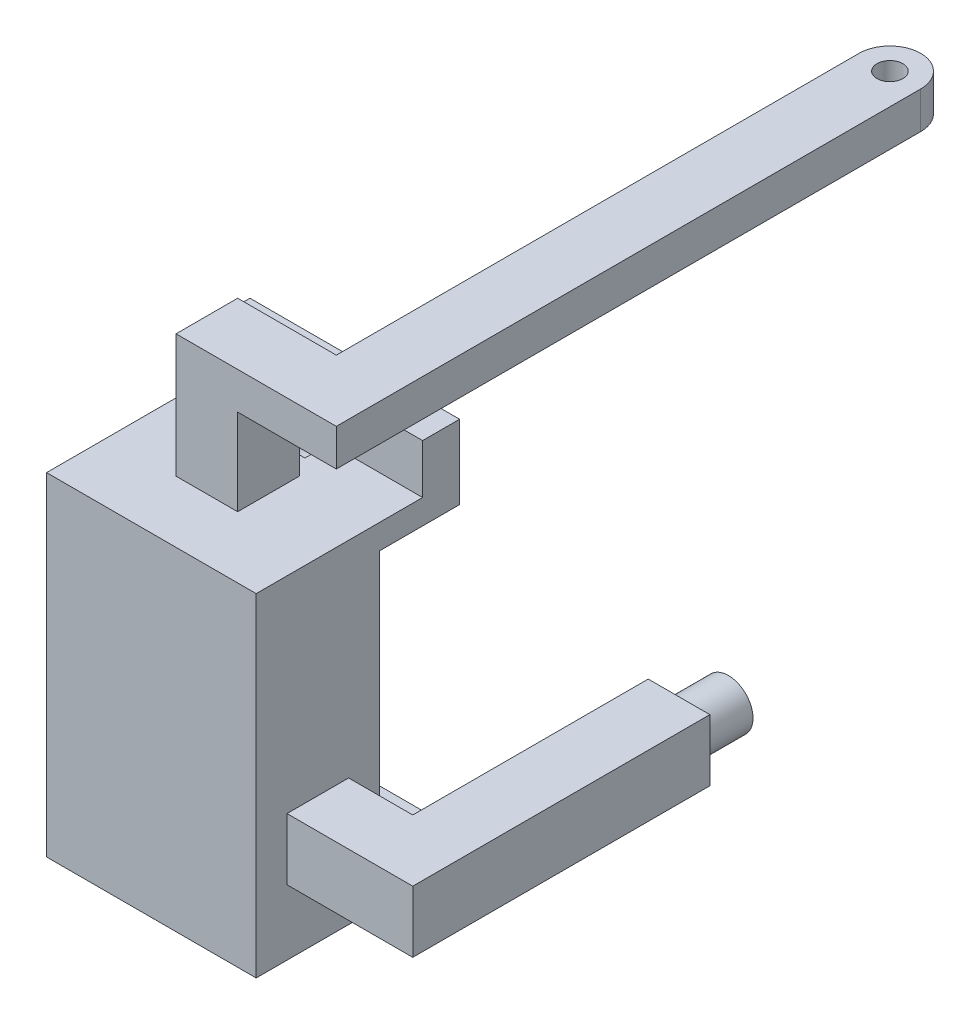
from build123d import *

# Parameters (mm, degrees)
SKETCH1_W            = 4.8
SKETCH1_H            = 4.8
BOSS_EXTRUDE1_DEPTH  = 1
SKETCH2_W            = 5.2
SKETCH2_H            = 5.2
BOSS_EXTRUDE2_DEPTH  = 50
SKETCH3_W            = 17
SKETCH3_H            = 27
BOSS_EXTRUDE3_DEPTH  = 10
SKETCH4_W            = 13
SKETCH4_H            = 23
CUT_EXTRUDE1_DEPTH   = 8.5
SKETCH5_W            = 11
SKETCH5_H            = 4.5
CUT_EXTRUDE2_DEPTH   = 4
SKETCH13_W           = 17
SKETCH13_H           = 27
CUT_EXTRUDE3_DEPTH   = 55.521738784
SKETCH14_W           = 17
SKETCH14_H           = 2
BOSS_EXTRUDE5_DEPTH  = 6.5
SKETCH15_W           = 17
SKETCH15_H           = 3
BOSS_EXTRUDE6_DEPTH  = 4
SKETCH16_R           = 0.95
CUT_EXTRUDE4_DEPTH   = 5
SKETCH17_W           = 5
SKETCH17_H           = 5
BOSS_EXTRUDE7_DEPTH  = 10.2
SKETCH18_W           = 5
SKETCH18_H           = 5
BOSS_EXTRUDE8_DEPTH  = 23.1
SKETCH19_W           = 5
SKETCH19_H           = 5
SKETCH19_R           = 2
CUT_EXTRUDE5_DEPTH   = 4
SKETCH20_R           = 0.5
CUT_EXTRUDE6_DEPTH   = 4
SKETCH21_W           = 5
SKETCH21_H           = 5
BOSS_EXTRUDE9_DEPTH  = 10
SKETCH22_W           = 5
SKETCH22_H           = 3
BOSS_EXTRUDE10_DEPTH = 42.402
SKETCH23_R           = 2.5
BOSS_EXTRUDE11_DEPTH = 3
SKETCH24_R           = 1.05
CUT_EXTRUDE7_DEPTH   = 3
SKETCH26_W           = 13
SKETCH26_H           = 5
BOSS_EXTRUDE12_DEPTH = 3
SKETCH28_W           = 5
SKETCH28_H           = 3
BOSS_EXTRUDE13_DEPTH = 42.402
SKETCH29_R           = 2.5
BOSS_EXTRUDE14_DEPTH = 3
SKETCH30_R           = 1.05
CUT_EXTRUDE8_DEPTH   = 3
SKETCH32_W           = 44.902
SKETCH32_H           = 3
CUT_EXTRUDE9_DEPTH   = 109.298336109


with BuildPart() as part:
    # Sketch1 → Boss-Extrude1 (new body)
    with BuildSketch(Plane.XY):
        with Locations((2.4, -2.4)):
            Rectangle(SKETCH1_W, SKETCH1_H)
    extrude(amount=BOSS_EXTRUDE1_DEPTH)

    # Sketch2 → Boss-Extrude2 (add)
    with BuildSketch(Plane(origin=(0, 0, 0), x_dir=(-1, 0, 0), z_dir=(0, 0, -1))):
        with Locations((-2.4, -2.4)):
            Rectangle(SKETCH2_W, SKETCH2_H)
    extrude(amount=BOSS_EXTRUDE2_DEPTH)

    # Sketch3 → Boss-Extrude3 (add)
    with BuildSketch(Plane(origin=(0, 0, -50), x_dir=(-1, 0, 0), z_dir=(0, 0, -1))):
        with Locations((-2.4, -2.4)):
            Rectangle(SKETCH3_W, SKETCH3_H)
    extrude(amount=BOSS_EXTRUDE3_DEPTH)

    # Sketch4 → Cut-Extrude1 (cut)
    with BuildSketch(Plane(origin=(0, 0, -60), x_dir=(-1, 0, 0), z_dir=(0, 0, -1))):
        with Locations((-2.4, -2.4)):
            Rectangle(SKETCH4_W, SKETCH4_H)
    extrude(amount=-CUT_EXTRUDE1_DEPTH, mode=Mode.SUBTRACT)

    # Sketch5 → Cut-Extrude2 (cut)
    with BuildSketch(Plane.XZ.offset(15.9)):
        with Locations((2.4, -55.25)):
            Rectangle(SKETCH5_W, SKETCH5_H)
    extrude(amount=-CUT_EXTRUDE2_DEPTH, mode=Mode.SUBTRACT)

    # Sketch13 → Cut-Extrude3 (cut, through all)
    with BuildSketch(Plane.XY.offset(-50)):
        with Locations((2.4, -2.4)):
            Rectangle(SKETCH13_W, SKETCH13_H)
    extrude(amount=CUT_EXTRUDE3_DEPTH, mode=Mode.SUBTRACT)

    # Sketch14 → Boss-Extrude5 (add)
    with BuildSketch(Plane(origin=(0, 0, -60), x_dir=(-1, 0, 0), z_dir=(0, 0, -1))):
        with Locations((-2.4, 10.1)):
            Rectangle(SKETCH14_W, SKETCH14_H)
    boss_extrude5 = extrude(amount=BOSS_EXTRUDE5_DEPTH)

    # Sketch15 → Boss-Extrude6 (add)
    with BuildSketch(Plane(origin=(0, 11.1, 0), x_dir=(1, 0, 0), z_dir=(0, 1, 0))):
        with Locations((2.4, 65)):
            Rectangle(SKETCH15_W, SKETCH15_H)
    boss_extrude6 = extrude(amount=BOSS_EXTRUDE6_DEPTH)

    # Sketch16 → Cut-Extrude4 (cut)
    with BuildSketch(Plane(origin=(0, 0, -66.5), x_dir=(-1, 0, 0), z_dir=(0, 0, -1))):
        with Locations((-2.4, 11.1)):
            Circle(SKETCH16_R)
    cut_extrude4 = extrude(amount=-CUT_EXTRUDE4_DEPTH, mode=Mode.SUBTRACT)

    # Mirror2: Boss-Extrude5, Boss-Extrude6, Cut-Extrude4 across plane
    add(boss_extrude5.mirror(Plane(origin=(0, -2.4, 0), x_dir=(0, 0, 1), z_dir=(0, -1, 0))))
    add(boss_extrude6.mirror(Plane(origin=(0, -2.4, 0), x_dir=(0, 0, 1), z_dir=(0, -1, 0))))
    add(cut_extrude4.mirror(Plane(origin=(0, -2.4, 0), x_dir=(0, 0, 1), z_dir=(0, -1, 0))), mode=Mode.SUBTRACT)

    # Sketch17 → Boss-Extrude7 (add)
    with BuildSketch(Plane(origin=(10.9, 0, 0), x_dir=(0, 0, -1), z_dir=(1, 0, 0))):
        with Locations((55, -8.1)):
            Rectangle(SKETCH17_W, SKETCH17_H)
    extrude(amount=BOSS_EXTRUDE7_DEPTH)

    # Sketch18 → Boss-Extrude8 (add)
    with BuildSketch(Plane(origin=(0, 0, -57.5), x_dir=(-1, 0, 0), z_dir=(0, 0, -1))):
        with Locations((-18.6, -8.1)):
            Rectangle(SKETCH18_W, SKETCH18_H)
    extrude(amount=BOSS_EXTRUDE8_DEPTH)

    # Sketch19 → Cut-Extrude5 (cut)
    with BuildSketch(Plane(origin=(0, 0, -80.6), x_dir=(-1, 0, 0), z_dir=(0, 0, -1))):
        with Locations((-18.6, -8.1)):
            Rectangle(SKETCH19_W, SKETCH19_H)
        with Locations((-18.6, -8.1)):
            Circle(SKETCH19_R, mode=Mode.SUBTRACT)
    extrude(amount=-CUT_EXTRUDE5_DEPTH, mode=Mode.SUBTRACT)

    # Sketch20 → Cut-Extrude6 (cut)
    with BuildSketch(Plane(origin=(0, 0, -80.6), x_dir=(-1, 0, 0), z_dir=(0, 0, -1))):
        with Locations((-18.6, -8.1)):
            Circle(SKETCH20_R)
    extrude(amount=-CUT_EXTRUDE6_DEPTH, mode=Mode.SUBTRACT)

    # Sketch21 → Boss-Extrude9 (add)
    with BuildSketch(Plane(origin=(0, 11.1, 0), x_dir=(1, 0, 0), z_dir=(0, 1, 0))):
        with Locations((1.9, 57.5)):
            Rectangle(SKETCH21_W, SKETCH21_H)
    extrude(amount=BOSS_EXTRUDE9_DEPTH)

    # Sketch22 → Boss-Extrude10 (add)
    with BuildSketch(Plane(origin=(0, 0, -60), x_dir=(-1, 0, 0), z_dir=(0, 0, -1))):
        with Locations((-1.9, 19.6)):
            Rectangle(SKETCH22_W, SKETCH22_H)
    extrude(amount=BOSS_EXTRUDE10_DEPTH)

    # Sketch23 → Boss-Extrude11 (add)
    with BuildSketch(Plane(origin=(0, 21.1, 0), x_dir=(1, 0, 0), z_dir=(0, 1, 0))):
        with Locations((1.9, 102.402)):
            Circle(SKETCH23_R)
    extrude(amount=-BOSS_EXTRUDE11_DEPTH)

    # Sketch24 → Cut-Extrude7 (cut)
    with BuildSketch(Plane(origin=(0, 21.1, 0), x_dir=(1, 0, 0), z_dir=(0, 1, 0))):
        with Locations(Location((1.9, 102.402, 0), (0, 0, 270))):
            Circle(SKETCH24_R)
    extrude(amount=-CUT_EXTRUDE7_DEPTH, mode=Mode.SUBTRACT)

    # Sketch26 → Boss-Extrude12 (add)
    with BuildSketch(Plane(origin=(0, 21.1, 0), x_dir=(1, 0, 0), z_dir=(0, 1, 0))):
        with Locations((5.9, 57.5)):
            Rectangle(SKETCH26_W, SKETCH26_H)
    extrude(amount=-BOSS_EXTRUDE12_DEPTH)

    # Sketch28 → Boss-Extrude13 (add)
    with BuildSketch(Plane(origin=(0, 0, -60), x_dir=(-1, 0, 0), z_dir=(0, 0, -1))):
        with Locations((-9.9, 19.6)):
            Rectangle(SKETCH28_W, SKETCH28_H)
    extrude(amount=BOSS_EXTRUDE13_DEPTH)

    # Sketch29 → Boss-Extrude14 (add)
    with BuildSketch(Plane(origin=(0, 21.1, 0), x_dir=(1, 0, 0), z_dir=(0, 1, 0))):
        with Locations((9.9, 102.402)):
            Circle(SKETCH29_R)
    extrude(amount=-BOSS_EXTRUDE14_DEPTH)

    # Sketch30 → Cut-Extrude8 (cut)
    with BuildSketch(Plane(origin=(0, 21.1, 0), x_dir=(1, 0, 0), z_dir=(0, 1, 0))):
        with Locations(Location((9.9, 102.402, 0), (0, 0, 270))):
            Circle(SKETCH30_R)
    extrude(amount=-CUT_EXTRUDE8_DEPTH, mode=Mode.SUBTRACT)

    # Sketch32 → Cut-Extrude9 (cut, through all)
    with BuildSketch(Plane(origin=(4.4, 0, 0), x_dir=(0, 0, -1), z_dir=(1, 0, 0))):
        with Locations((82.451, 19.6)):
            Rectangle(SKETCH32_W, SKETCH32_H)
    extrude(amount=-CUT_EXTRUDE9_DEPTH, mode=Mode.SUBTRACT)


solid = part.part
